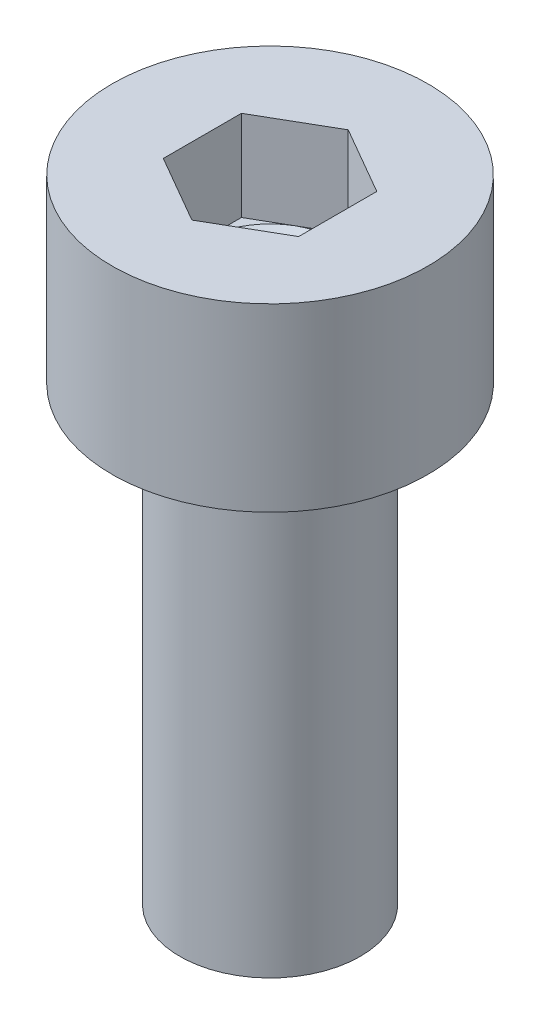
from build123d import *

# Parameters (mm, degrees)
CUT_EXTRUDE1_DEPTH = 2


with BuildPart() as part:
    # Sketch1 → Revolve1 (revolve)
    with BuildSketch(Plane.XY, mode=Mode.PRIVATE) as revolve1_sk:
        Polygon((0, 0), (3.5, 0), (3.5, -4), (2, -4), (2, -14), (0, -14), align=None)
    revolve(revolve1_sk.sketch.rotate(Axis((0, 0, 0), (0, -1, 0)), 180), axis=Axis((0, 0, 0), (0, -1, 0)))

    # Sketch2 → Cut-Revolve1 (revolve, cut)
    with BuildSketch(Plane.XY, mode=Mode.PRIVATE) as cut_revolve1_sk:
        Polygon((1.5, 0), (1.5, -2), (0, -2.866025404), (0, 0), align=None)
    revolve(cut_revolve1_sk.sketch.rotate(Axis((0, 0, 0), (0, -1, 0)), 180), axis=Axis((0, 0, 0), (0, -1, 0)), mode=Mode.SUBTRACT)

    # Sketch3 → Cut-Extrude1 (cut)
    with BuildSketch(Plane(origin=(0, 0, 0), x_dir=(1, 0, 0), z_dir=(0, 1, 0))):
        Polygon((0, 1.732050808), (-1.5, 0.866025404), (-1.5, -0.866025404), (0, -1.732050808), (1.5, -0.866025404), (1.5, 0.866025404), align=None)
    extrude(amount=-CUT_EXTRUDE1_DEPTH, mode=Mode.SUBTRACT)


solid = part.part
